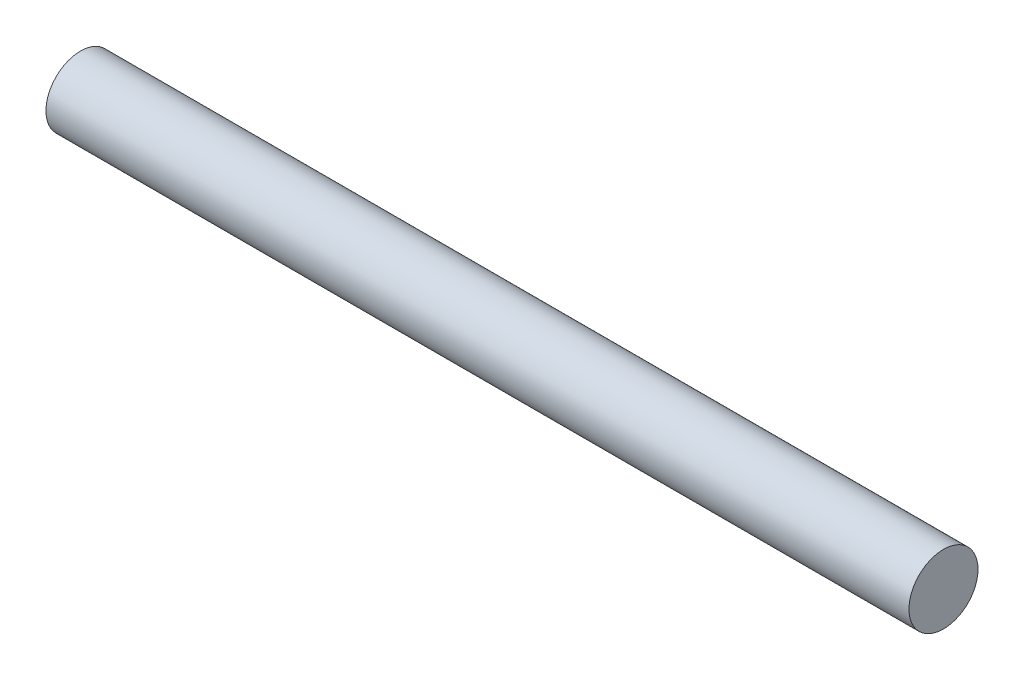
from build123d import *

# Parameters (mm, degrees)
CROQUIS1_R              = 4
SALIENTE_EXTRUIR1_DEPTH = 100


with BuildPart() as part:
    # Croquis1 → Saliente-Extruir1 (new body)
    with BuildSketch(Plane(origin=(0, 0, 0), x_dir=(0, 0, -1), z_dir=(1, 0, 0))):
        Circle(CROQUIS1_R)
    extrude(amount=SALIENTE_EXTRUIR1_DEPTH)


solid = part.part
